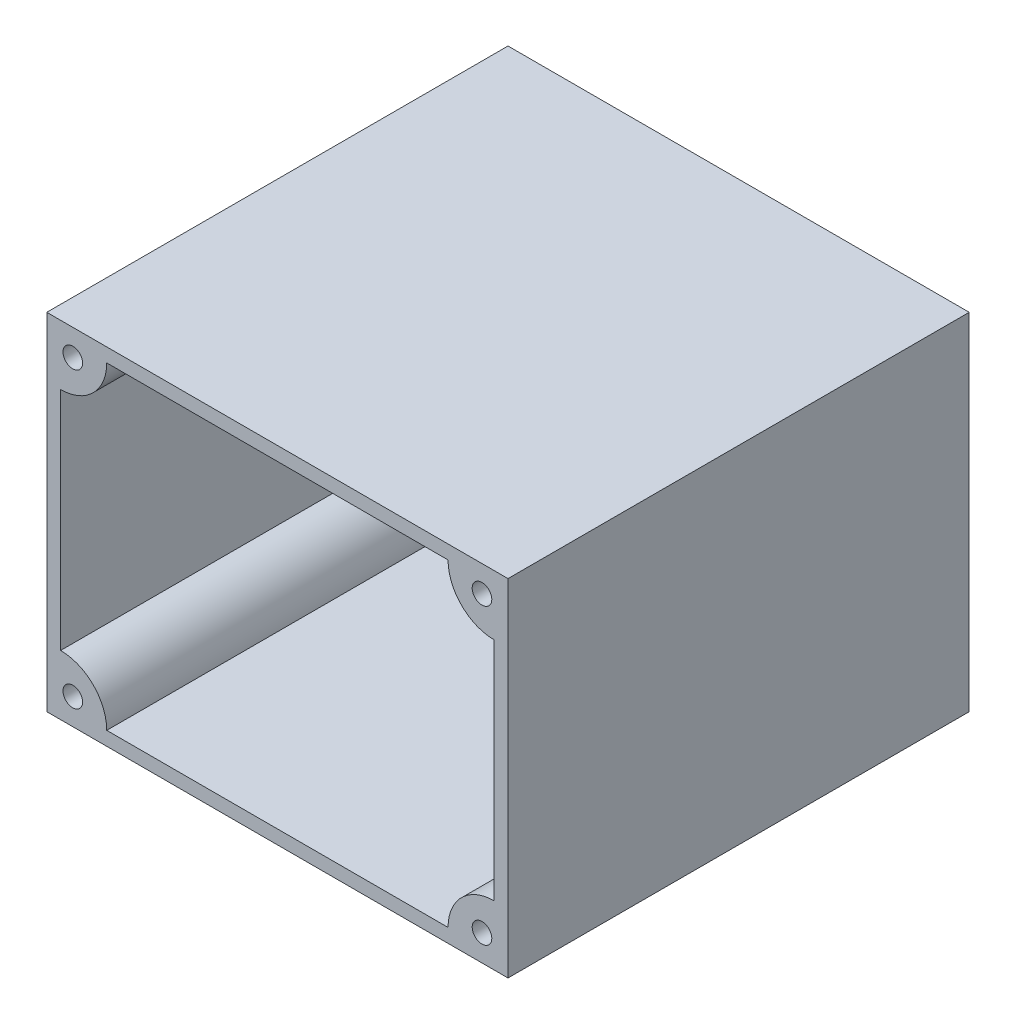
from build123d import *

# Parameters (mm, degrees)
ESQUISSE1_W                                = 80
ESQUISSE1_H                                = 60
BOSS_EXTRU_1_DEPTH                         = 80
COQUE1_T                                   = -2.4
BOSS_EXTRU_2_REACH                         = 96.34
SYM_TRIE1_AT_THE_SECOND_PLANE_COPY_1_REACH = 96.34


with BuildPart() as part:
    # Esquisse1 → Boss.-Extru.1 (new body)
    with BuildSketch(Plane.XY):
        Rectangle(ESQUISSE1_W, ESQUISSE1_H)
    extrude(amount=BOSS_EXTRU_1_DEPTH)

    # Coque1
    coque1_openings = [part.faces().sort_by_distance(p)[0] for p in [
        (0, 0, 80),
    ]]
    offset(amount=COQUE1_T, openings=coque1_openings, kind=Kind.INTERSECTION)

    # Esquisse2 → Boss.-Extru.2 (add, up to next)
    with BuildSketch(Plane.XY.offset(80), mode=Mode.PRIVATE) as boss_extru_2_sk1:
        with BuildLine():
            Line((-37.6, 27.6), (-37.6, 19.6))
            ThreePointArc((-37.6, 19.6), (-31.943145751, 21.943145751), (-29.6, 27.6))
            Line((-29.6, 27.6), (-37.6, 27.6))
        make_face()
    boss_extru_2_tool1 = extrude(boss_extru_2_sk1.sketch, amount=-BOSS_EXTRU_2_REACH, mode=Mode.PRIVATE) - part.part
    boss_extru_2 = boss_extru_2_tool1.solids().sort_by_distance((-34.204695, 24.204695, 80))[0]
    add(boss_extru_2)

    # Esquisse4 → Dégagement M31 (revolve, cut)
    with BuildSketch(Plane(origin=(-35.488231032, 25.460651403, 80), x_dir=(0, -1, 0), z_dir=(1, 0, 0))):
        Polygon((0, 0), (0, 11.021463052), (1.7, 10), (1.7, 0), align=None)
    d_gagement_m31 = revolve(axis=Axis((-35.488231032, 25.460651403, 86.35), (0, 0, -1)), mode=Mode.SUBTRACT)

    # Symétrie1: Boss.-Extru.2, Dégagement M31 across plane
    add(boss_extru_2.mirror(Plane(origin=(0, 0, 0), x_dir=(0, 0, 1), z_dir=(1, 0, 0))))
    add(d_gagement_m31.mirror(Plane(origin=(0, 0, 0), x_dir=(0, 0, 1), z_dir=(1, 0, 0))), mode=Mode.SUBTRACT)

    # Symétrie1 at the second plane: Boss.-Extru.2, Dégagement M31 across plane
    add(boss_extru_2.mirror(Plane.ZX))
    add(d_gagement_m31.mirror(Plane.ZX), mode=Mode.SUBTRACT)

    # Symétrie1 at the second plane copy 1 ske → Symétrie1 at the second plane copy 1 (add, up to next)
    with BuildSketch(Plane(origin=(0, 0, 80), x_dir=(-1, 0, 0), z_dir=(0, 0, 1)), mode=Mode.PRIVATE) as sym_trie1_at_the_second_plane_copy_1_sk1:
        with BuildLine():
            Line((-37.6, 27.6), (-37.6, 19.6))
            ThreePointArc((-37.6, 19.6), (-31.943145751, 21.943145751), (-29.6, 27.6))
            Line((-29.6, 27.6), (-37.6, 27.6))
        make_face()
    sym_trie1_at_the_second_plane_copy_1_tool1 = extrude(sym_trie1_at_the_second_plane_copy_1_sk1.sketch, amount=-SYM_TRIE1_AT_THE_SECOND_PLANE_COPY_1_REACH, mode=Mode.PRIVATE) - part.part
    add(sym_trie1_at_the_second_plane_copy_1_tool1.solids().sort_by_distance((34.204695, -24.204695, 80))[0])

    # Symétrie1 at the second plane copy 2 ske → Symétrie1 at the second plane copy 2 (revolve, cut)
    with BuildSketch(Plane(origin=(35.488231032, -25.460651403, 80), x_dir=(0, 1, 0), z_dir=(-1, 0, 0))):
        Polygon((0, 0), (0, 11.021463052), (1.7, 10), (1.7, 0), align=None)
    revolve(axis=Axis((35.488231032, -25.460651403, 86.35), (0, 0, -1)), mode=Mode.SUBTRACT)


solid = part.part
